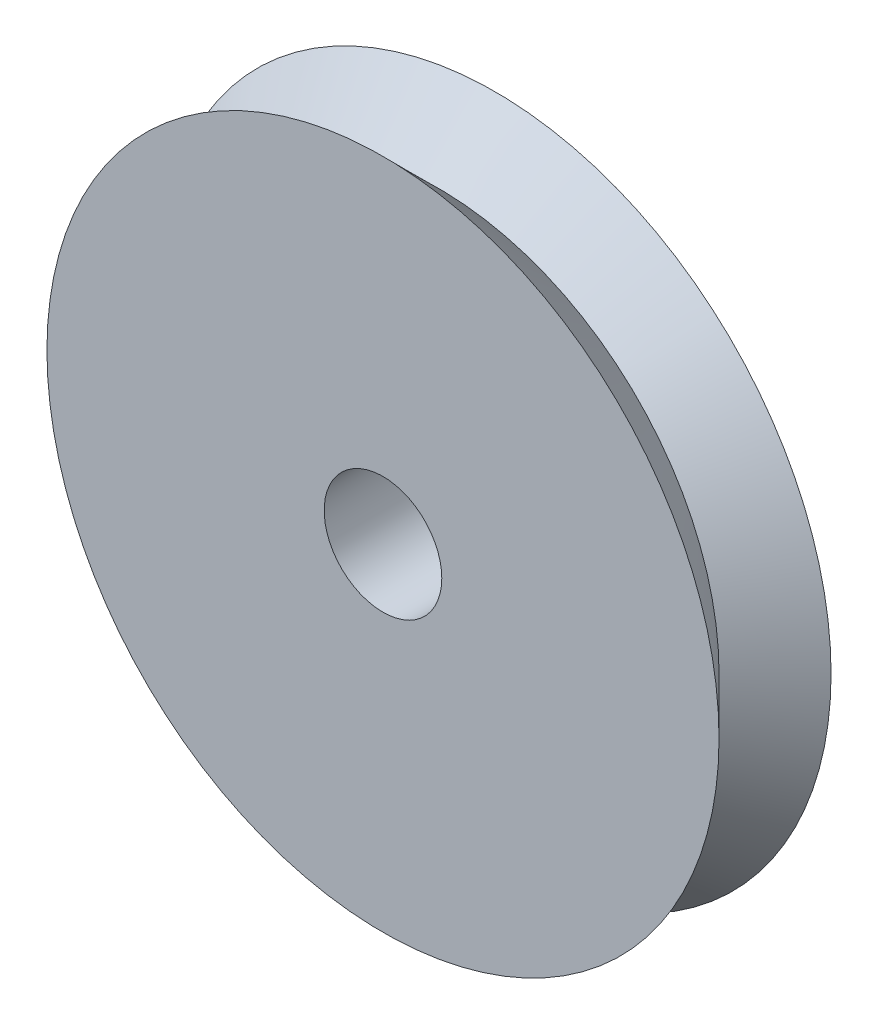
from build123d import *

# Parameters (mm, degrees)
SKETCH2_R          = 5.25
CUT_EXTRUDE1_DEPTH = 44.588989435


with BuildPart() as part:
    # Sketch1 → Revolve1 (revolve)
    with BuildSketch(Plane(origin=(0, 0, 0), x_dir=(1, 0, 0), z_dir=(0, 1, 0))):
        Polygon((-30, 0), (0, 0), (0, 10), (-30, 10), (-25, 5), align=None)
    revolve(axis=Axis((0, 0, 0), (0, 0, -1)))

    # Sketch2 → Cut-Extrude1 (cut, through all)
    with BuildSketch(Plane.XY):
        Circle(SKETCH2_R)
    extrude(amount=-CUT_EXTRUDE1_DEPTH, mode=Mode.SUBTRACT)


solid = part.part
